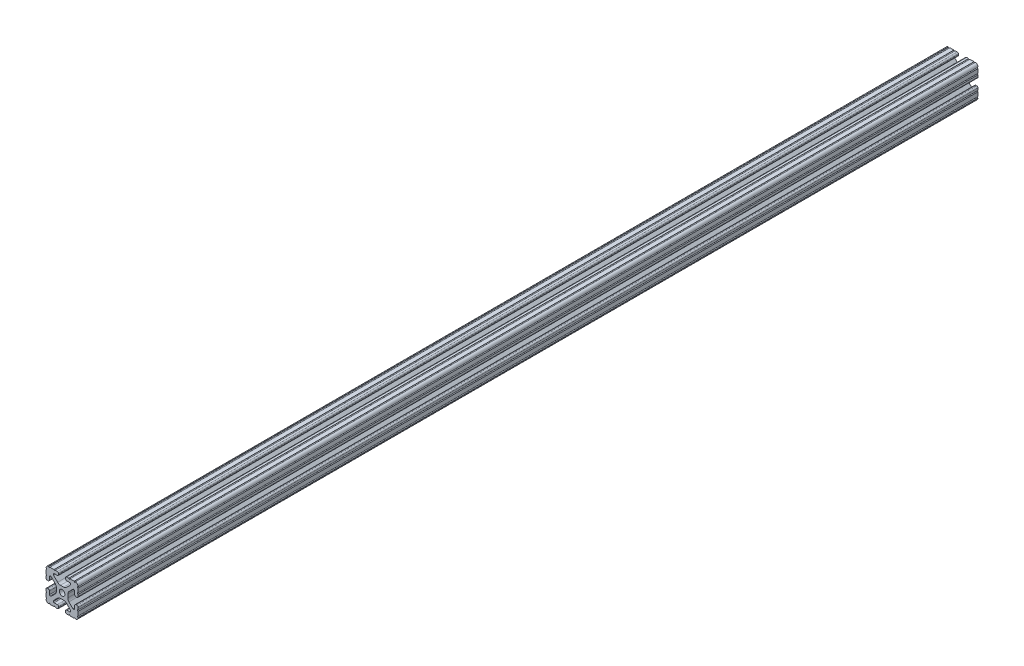
from build123d import *

# Parameters (mm, degrees)
SKETCH1_R      = 3.3274
EXTRUDE1_DEPTH = 1066.8


with BuildPart() as part:
    # Sketch1 → Extrude1 (new body)
    with BuildSketch(Plane.XY):
        with BuildLine():
            Line((-10.022898969, 12.91475973), (-5.252158105, 8.144007132))
            ThreePointArc((-5.252158105, 8.144007132), (-3.715177372, 7.117027388), (-1.902183975, 6.7564))
            Line((-1.902183975, 6.7564), (1.902183975, 6.7564))
            ThreePointArc((1.902183975, 6.7564), (3.715177372, 7.117027388), (5.252158105, 8.144007132))
            Line((5.252158105, 8.144007132), (10.022898969, 12.91475973))
            ThreePointArc((10.022898969, 12.91475973), (10.218362387, 13.207291992), (10.287, 13.552357131))
            Line((10.287, 13.552357131), (10.287, 14.0843))
            ThreePointArc((10.287, 14.0843), (10.022898185, 14.721898185), (9.3853, 14.986))
            Line((9.3853, 14.986), (5.617617549, 14.986))
            ThreePointArc((5.617617549, 14.986), (4.519044045, 15.441044045), (4.064, 16.539617549))
            Line((4.064, 16.539617549), (4.064, 17.496382451))
            ThreePointArc((4.064, 17.496382451), (4.519044045, 18.594955955), (5.617617549, 19.05))
            Line((5.617617549, 19.05), (7.974178704, 19.05))
            ThreePointArc((7.974178704, 19.05), (8.736178704, 18.288), (9.498178704, 19.05))
            Line((9.498178704, 19.05), (14.327719207, 19.05))
            ThreePointArc((14.327719207, 19.05), (15.087603123, 18.231251131), (15.847487039, 19.05))
            ThreePointArc((15.847487039, 19.05), (18.120176289, 18.120192083), (19.05, 15.847509295))
            ThreePointArc((19.05, 15.847509295), (18.231250992, 15.08762539), (19.05, 14.327741484))
            Line((19.05, 14.327741484), (19.05, 9.496091471))
            ThreePointArc((19.05, 9.496091471), (18.231250992, 8.736207565), (19.05, 7.97632366))
            Line((19.05, 7.97632366), (19.05, 5.617617549))
            ThreePointArc((19.05, 5.617617549), (18.594955955, 4.519044045), (17.496382451, 4.064))
            Line((17.496382451, 4.064), (16.539617549, 4.064))
            ThreePointArc((16.539617549, 4.064), (15.441044045, 4.519044045), (14.986, 5.617617549))
            Line((14.986, 5.617617549), (14.986, 9.385342516))
            ThreePointArc((14.986, 9.385342516), (14.721898185, 10.022940701), (14.0843, 10.287042516))
            Line((14.0843, 10.287042516), (13.516042086, 10.287042516))
            ThreePointArc((13.516042086, 10.287042516), (13.170975923, 10.218404478), (12.878443117, 10.022939917))
            Line((12.878443117, 10.022939917), (8.14758008, 5.292065243))
            ThreePointArc((8.14758008, 5.292065243), (7.117955879, 3.751120653), (6.7564, 1.933453584))
            Line((6.7564, 1.933453584), (6.7564, -1.933453584))
            ThreePointArc((6.7564, -1.933453584), (7.117955879, -3.751120653), (8.14758008, -5.292065243))
            Line((8.14758008, -5.292065243), (12.878443117, -10.022939917))
            ThreePointArc((12.878443117, -10.022939917), (13.170975923, -10.218404478), (13.516042086, -10.287042516))
            Line((13.516042086, -10.287042516), (14.0843, -10.287042516))
            ThreePointArc((14.0843, -10.287042516), (14.721898185, -10.022940701), (14.986, -9.385342516))
            Line((14.986, -9.385342516), (14.986, -5.617617549))
            ThreePointArc((14.986, -5.617617549), (15.441044045, -4.519044045), (16.539617549, -4.064))
            Line((16.539617549, -4.064), (17.496382451, -4.064))
            ThreePointArc((17.496382451, -4.064), (18.594955955, -4.519044045), (19.05, -5.617617549))
            Line((19.05, -5.617617549), (19.05, -7.976318491))
            ThreePointArc((19.05, -7.976318491), (18.231250992, -8.736202396), (19.05, -9.496086302))
            Line((19.05, -9.496086302), (19.05, -14.32774291))
            ThreePointArc((19.05, -14.32774291), (18.231250992, -15.087626816), (19.05, -15.847510721))
            ThreePointArc((19.05, -15.847510721), (18.120175716, -18.120192644), (15.847486868, -19.05))
            ThreePointArc((15.847486868, -19.05), (15.087602952, -18.231251131), (14.327719036, -19.05))
            Line((14.327719036, -19.05), (9.496062448, -19.05))
            ThreePointArc((9.496062448, -19.05), (8.736178532, -18.231251131), (7.976294616, -19.05))
            Line((7.976294616, -19.05), (5.617617549, -19.05))
            ThreePointArc((5.617617549, -19.05), (4.519044045, -18.594955955), (4.064, -17.496382451))
            Line((4.064, -17.496382451), (4.064, -16.539617549))
            ThreePointArc((4.064, -16.539617549), (4.519044045, -15.441044045), (5.617617549, -14.986))
            Line((5.617617549, -14.986), (9.3853, -14.986))
            ThreePointArc((9.3853, -14.986), (10.022898185, -14.721898185), (10.287, -14.0843))
            Line((10.287, -14.0843), (10.287, -13.552357131))
            ThreePointArc((10.287, -13.552357131), (10.218362387, -13.207291992), (10.022898969, -12.91475973))
            Line((10.022898969, -12.91475973), (5.252158105, -8.144007132))
            ThreePointArc((5.252158105, -8.144007132), (3.715177372, -7.117027388), (1.902183975, -6.7564))
            Line((1.902183975, -6.7564), (-1.902183975, -6.7564))
            ThreePointArc((-1.902183975, -6.7564), (-3.715177372, -7.117027388), (-5.252158105, -8.144007132))
            Line((-5.252158105, -8.144007132), (-10.022898969, -12.91475973))
            ThreePointArc((-10.022898969, -12.91475973), (-10.218362387, -13.207291992), (-10.287, -13.552357131))
            Line((-10.287, -13.552357131), (-10.287, -14.0843))
            ThreePointArc((-10.287, -14.0843), (-10.022898185, -14.721898185), (-9.3853, -14.986))
            Line((-9.3853, -14.986), (-5.617617549, -14.986))
            ThreePointArc((-5.617617549, -14.986), (-4.519044045, -15.441044045), (-4.064, -16.539617549))
            Line((-4.064, -16.539617549), (-4.064, -17.496382451))
            ThreePointArc((-4.064, -17.496382451), (-4.519044045, -18.594955955), (-5.617617549, -19.05))
            Line((-5.617617549, -19.05), (-7.976294616, -19.05))
            ThreePointArc((-7.976294616, -19.05), (-8.736178532, -18.231251131), (-9.496062448, -19.05))
            Line((-9.496062448, -19.05), (-14.327719036, -19.05))
            ThreePointArc((-14.327719036, -19.05), (-15.087602952, -18.231251131), (-15.847486868, -19.05))
            ThreePointArc((-15.847486868, -19.05), (-18.120175716, -18.120192644), (-19.05, -15.847510721))
            ThreePointArc((-19.05, -15.847510721), (-18.231250992, -15.087626816), (-19.05, -14.32774291))
            Line((-19.05, -14.32774291), (-19.05, -9.496086302))
            ThreePointArc((-19.05, -9.496086302), (-18.231250992, -8.736202396), (-19.05, -7.976318491))
            Line((-19.05, -7.976318491), (-19.05, -5.617617549))
            ThreePointArc((-19.05, -5.617617549), (-18.594955955, -4.519044045), (-17.496382451, -4.064))
            Line((-17.496382451, -4.064), (-16.539617549, -4.064))
            ThreePointArc((-16.539617549, -4.064), (-15.441044045, -4.519044045), (-14.986, -5.617617549))
            Line((-14.986, -5.617617549), (-14.986, -9.385342516))
            ThreePointArc((-14.986, -9.385342516), (-14.721898185, -10.022940701), (-14.0843, -10.287042516))
            Line((-14.0843, -10.287042516), (-13.516042086, -10.287042516))
            ThreePointArc((-13.516042086, -10.287042516), (-13.170975923, -10.218404478), (-12.878443117, -10.022939917))
            Line((-12.878443117, -10.022939917), (-8.14758008, -5.292065243))
            ThreePointArc((-8.14758008, -5.292065243), (-7.117955879, -3.751120653), (-6.7564, -1.933453584))
            Line((-6.7564, -1.933453584), (-6.7564, 1.933453584))
            ThreePointArc((-6.7564, 1.933453584), (-7.117955879, 3.751120653), (-8.14758008, 5.292065243))
            Line((-8.14758008, 5.292065243), (-12.878443117, 10.022939917))
            ThreePointArc((-12.878443117, 10.022939917), (-13.170975923, 10.218404478), (-13.516042086, 10.287042516))
            Line((-13.516042086, 10.287042516), (-14.0843, 10.287042516))
            ThreePointArc((-14.0843, 10.287042516), (-14.721898185, 10.022940701), (-14.986, 9.385342516))
            Line((-14.986, 9.385342516), (-14.986, 5.617617549))
            ThreePointArc((-14.986, 5.617617549), (-15.441044045, 4.519044045), (-16.539617549, 4.064))
            Line((-16.539617549, 4.064), (-17.496382451, 4.064))
            ThreePointArc((-17.496382451, 4.064), (-18.594955955, 4.519044045), (-19.05, 5.617617549))
            Line((-19.05, 5.617617549), (-19.05, 7.97632366))
            ThreePointArc((-19.05, 7.97632366), (-18.231250992, 8.736207565), (-19.05, 9.496091471))
            Line((-19.05, 9.496091471), (-19.05, 14.327741484))
            ThreePointArc((-19.05, 14.327741484), (-18.231250992, 15.08762539), (-19.05, 15.847509295))
            ThreePointArc((-19.05, 15.847509295), (-18.120176289, 18.120192083), (-15.847487039, 19.05))
            ThreePointArc((-15.847487039, 19.05), (-15.087603123, 18.231251131), (-14.327719207, 19.05))
            Line((-14.327719207, 19.05), (-9.498178704, 19.05))
            ThreePointArc((-9.498178704, 19.05), (-8.736178704, 18.288), (-7.974178704, 19.05))
            Line((-7.974178704, 19.05), (-5.617617549, 19.05))
            ThreePointArc((-5.617617549, 19.05), (-4.519044045, 18.594955955), (-4.064, 17.496382451))
            Line((-4.064, 17.496382451), (-4.064, 16.539617549))
            ThreePointArc((-4.064, 16.539617549), (-4.519044045, 15.441044045), (-5.617617549, 14.986))
            Line((-5.617617549, 14.986), (-9.3853, 14.986))
            ThreePointArc((-9.3853, 14.986), (-10.022898185, 14.721898185), (-10.287, 14.0843))
            Line((-10.287, 14.0843), (-10.287, 13.552357131))
            ThreePointArc((-10.287, 13.552357131), (-10.218362387, 13.207291992), (-10.022898969, 12.91475973))
        make_face()
        Circle(SKETCH1_R, mode=Mode.SUBTRACT)
    extrude(amount=-EXTRUDE1_DEPTH)


solid = part.part
